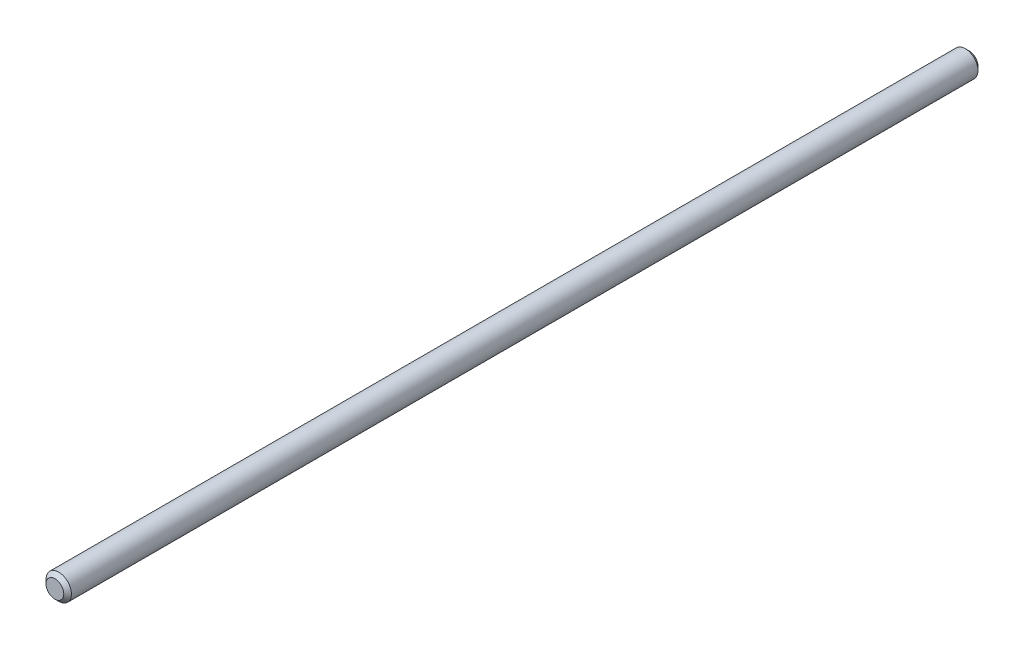
from build123d import *

# Parameters (mm, degrees)
SKETCH1_R           = 2.5
BOSS_EXTRUDE1_DEPTH = 180
CHAMFER1_SIZE       = 0.75


with BuildPart() as part:
    # Sketch1 → Boss-Extrude1 (new body)
    with BuildSketch(Plane.XY):
        with Locations(Location((0, 0, 0), (0, 0, 180))):
            Circle(SKETCH1_R)
    extrude(amount=BOSS_EXTRUDE1_DEPTH)

    # Chamfer1
    chamfer1_edges = [part.edges().sort_by_distance(p)[0] for p in [
        (2.5, 0, 0),
        (2.5, 0, 180),
    ]]
    chamfer(chamfer1_edges, length=CHAMFER1_SIZE)


solid = part.part
